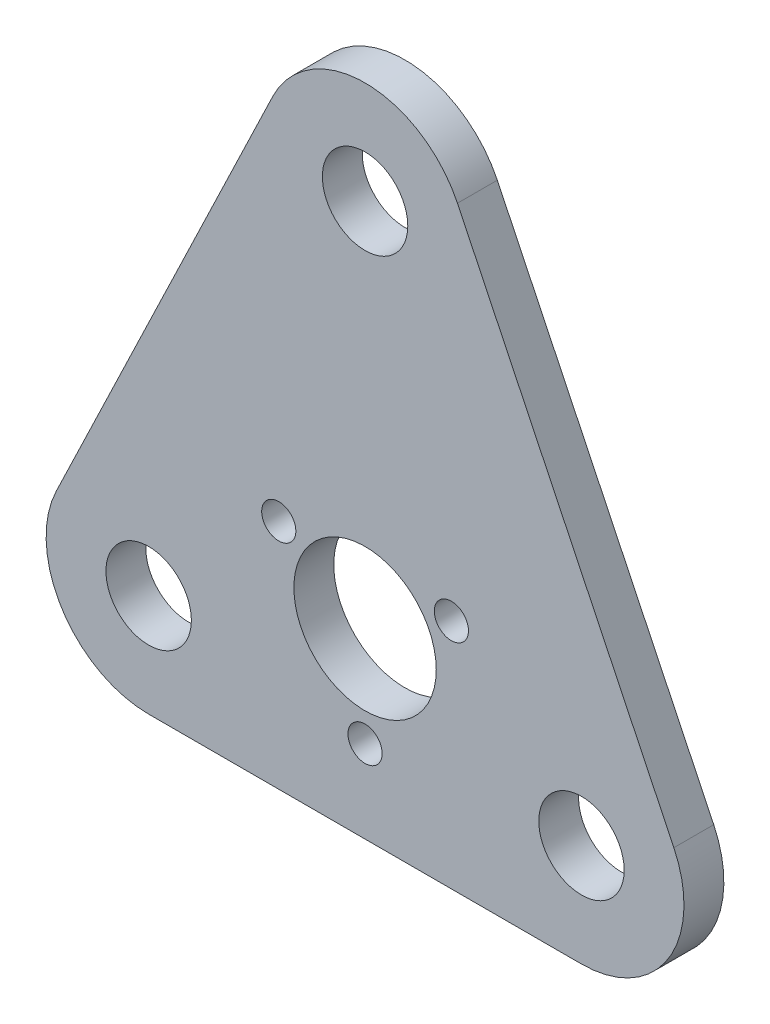
from build123d import *

# Parameters (mm, degrees)
SKETCH1_R           = 7.5
SKETCH1_R_2         = 12.5
SKETCH1_R_3         = 3
BOSS_EXTRUDE1_DEPTH = 3.5


with BuildPart() as part:
    # Sketch1 → Boss-Extrude1 (new, symmetric)
    with BuildSketch(Plane.XY):
        with BuildLine():
            Line((-16.221001351, 86.802506979), (-54.221001351, 7.802506979))
            ThreePointArc((-54.221001351, 7.802506979), (-53.238850443, -9.580054133), (-38, -18))
            Line((-38, -18), (38, -18))
            ThreePointArc((38, -18), (53.238850443, -9.580054133), (54.221001351, 7.802506979))
            Line((54.221001351, 7.802506979), (16.221001351, 86.802506979))
            ThreePointArc((16.221001351, 86.802506979), (0, 97), (-16.221001351, 86.802506979))
        make_face()
        with Locations((-38, 0)):
            Circle(SKETCH1_R, mode=Mode.SUBTRACT)
        with Locations((38, 0)):
            Circle(SKETCH1_R, mode=Mode.SUBTRACT)
        with Locations((0, 79)):
            Circle(SKETCH1_R, mode=Mode.SUBTRACT)
        with Locations((0, 14)):
            Circle(SKETCH1_R_2, mode=Mode.SUBTRACT)
        with Locations((-15.155444566, 22.75)):
            Circle(SKETCH1_R_3, mode=Mode.SUBTRACT)
        with Locations((15.155444566, 22.75)):
            Circle(SKETCH1_R_3, mode=Mode.SUBTRACT)
        with Locations((0, -3.5)):
            Circle(SKETCH1_R_3, mode=Mode.SUBTRACT)
    extrude(amount=BOSS_EXTRUDE1_DEPTH, both=True)


solid = part.part
